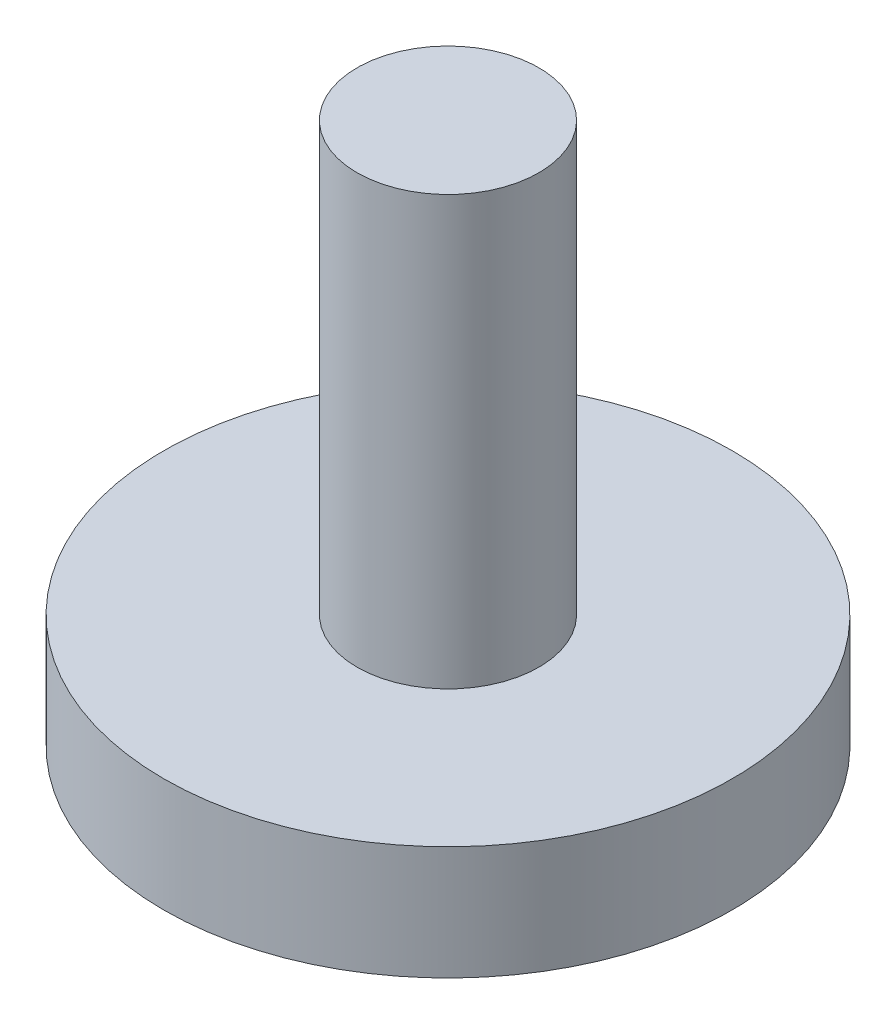
from build123d import *

# Parameters (mm, degrees)
SKETCH1_R           = 7.5
BOSS_EXTRUDE1_DEPTH = 3
SKETCH2_R           = 2.4
BOSS_EXTRUDE2_DEPTH = 11.3


with BuildPart() as part:
    # Sketch1 → Boss-Extrude1 (new body)
    with BuildSketch(Plane(origin=(0, 0, 0), x_dir=(1, 0, 0), z_dir=(0, 1, 0))):
        with Locations(Location((0, 0, 0), (0, 0, 270))):
            Circle(SKETCH1_R)
    extrude(amount=BOSS_EXTRUDE1_DEPTH)

    # Sketch2 → Boss-Extrude2 (add)
    with BuildSketch(Plane(origin=(0, 3, 0), x_dir=(1, 0, 0), z_dir=(0, 1, 0))):
        with Locations(Location((0, 0, 0), (0, 0, 270))):
            Circle(SKETCH2_R)
    extrude(amount=BOSS_EXTRUDE2_DEPTH)


solid = part.part
